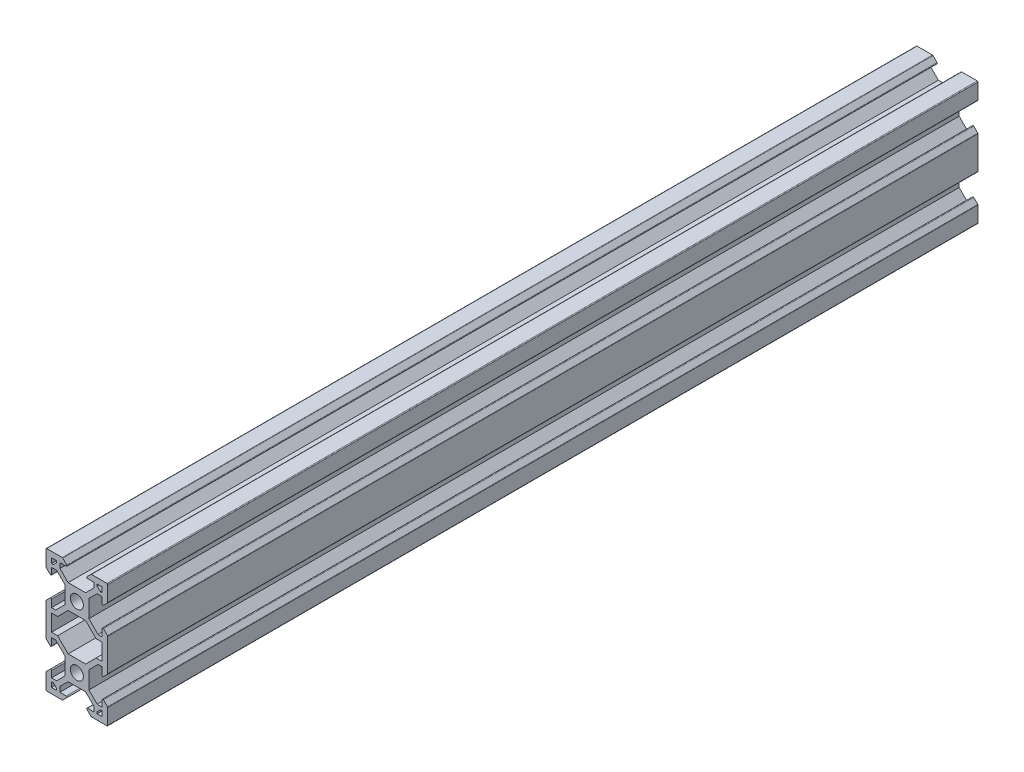
from build123d import *

# Parameters (mm, degrees)
SKETCH1_R            = 2.1
BOSS_EXTRUDE2_DEPTH  = 282
CUT_EXTRUDE1_DEPTH   = 283.354387474
FILLET1_R            = 0.25
FILLET1_OF_MIRROR1_R = 0.25


with BuildPart() as part:
    # Sketch1 → Boss-Extrude2 (new body)
    with BuildSketch(Plane.XY):
        Polygon((8.199993721, -10), (9.999993721, -10), (9.999993721, -4.63999575), (8.199993721, -2.84), (8.199993721, -5.800653822), (6.861313026, -5.800653822), (3.900652213, -2.84), (3.900652213, 2.84), (6.559993721, 5.499347787), (8.199993721, 5.499347787), (8.199993721, 2.84), (9.999993721, 4.64000425), (9.999993721, 10), (4.63999575, 10), (2.84, 8.2), (5.499325592, 8.2), (5.499325592, 6.56), (2.84, 3.900668129), (-2.84, 3.900668129), (-5.49933815, 6.56), (-5.49933815, 8.2), (-2.84, 8.2), (-4.64000425, 10), (-10.000006279, 10), (-10.000006279, 4.63999575), (-8.200006279, 2.84), (-8.200006279, 5.499347787), (-6.560006279, 5.499347787), (-3.900652213, 2.84), (-3.900652213, -2.84), (-6.861299044, -5.800653822), (-8.200006279, -5.800653822), (-8.200006279, -2.84), (-10.000006279, -4.64000425), (-10.000006279, -10), (-8.200006279, -10), (-8.200006279, -7.300653822), (-6.239977665, -7.300653822), (-2.84, -3.900668129), (2.84, -3.900668129), (6.239993721, -7.300653822), (8.199993721, -7.300653822), align=None)
        with Locations(Location((0, 0, 0), (0, 0, 180))):
            Circle(SKETCH1_R, mode=Mode.SUBTRACT)
    boss_extrude2 = extrude(amount=BOSS_EXTRUDE2_DEPTH)

    # Sketch2 → Cut-Extrude1 (cut, through all)
    with BuildSketch(Plane.XY.offset(282)):
        Polygon((-8.200006279, 6.569347787), (-8.200006279, 8.2), (-6.56933815, 8.2), (-6.56933815, 7.630009211), (-7.62999707, 6.569347787), align=None)
        Polygon((8.199993721, 8.2), (8.199993721, 6.569347787), (7.629987016, 6.569347787), (6.569325592, 7.630006706), (6.569325592, 8.2), align=None)
    cut_extrude1 = extrude(amount=-CUT_EXTRUDE1_DEPTH, mode=Mode.SUBTRACT)

    # Fillet1
    fillet1_edges = [part.edges().sort_by_distance(p)[0] for p in [
        (9.999993721, -4.63999575, 141),
        (-10.000006279, -4.64000425, 141),
        (-8.200006279, -2.84, 141),
        (-8.200006279, 2.84, 141),
        (-10.000006279, 4.63999575, 141),
        (-10.000006279, 10, 141),
        (-4.64000425, 10, 141),
        (-2.84, 8.2, 141),
        (2.84, 8.2, 141),
        (4.63999575, 10, 141),
        (9.999993721, 10, 141),
        (9.999993721, 4.64000425, 141),
        (8.199993721, 2.84, 141),
        (8.199993721, -2.84, 141),
    ]]
    fillet(fillet1_edges, radius=FILLET1_R)

    # Mirror1: Boss-Extrude2 across plane
    add(boss_extrude2.mirror(Plane(origin=(0, -10, 0), x_dir=(0, 0, 1), z_dir=(0, -1, 0))))

    # Fillet1 of Mirror1
    fillet1_of_mirror1_edges = [part.edges().sort_by_distance(p)[0] for p in [
        (9.999993721, -15.36000425, 141),
        (-10.000006279, -15.35999575, 141),
        (-8.200006279, -17.16, 141),
        (-8.200006279, -22.84, 141),
        (-10.000006279, -24.63999575, 141),
        (-10.000006279, -30, 141),
        (-4.64000425, -30, 141),
        (-2.84, -28.2, 141),
        (2.84, -28.2, 141),
        (4.63999575, -30, 141),
        (9.999993721, -30, 141),
        (9.999993721, -24.64000425, 141),
        (8.199993721, -22.84, 141),
        (8.199993721, -17.16, 141),
    ]]
    fillet(fillet1_of_mirror1_edges, radius=FILLET1_OF_MIRROR1_R)

    # Mirror2: Cut-Extrude1 across plane
    add(cut_extrude1.mirror(Plane(origin=(0, -10, 0), x_dir=(0, 0, 1), z_dir=(0, -1, 0))), mode=Mode.SUBTRACT)


solid = part.part
